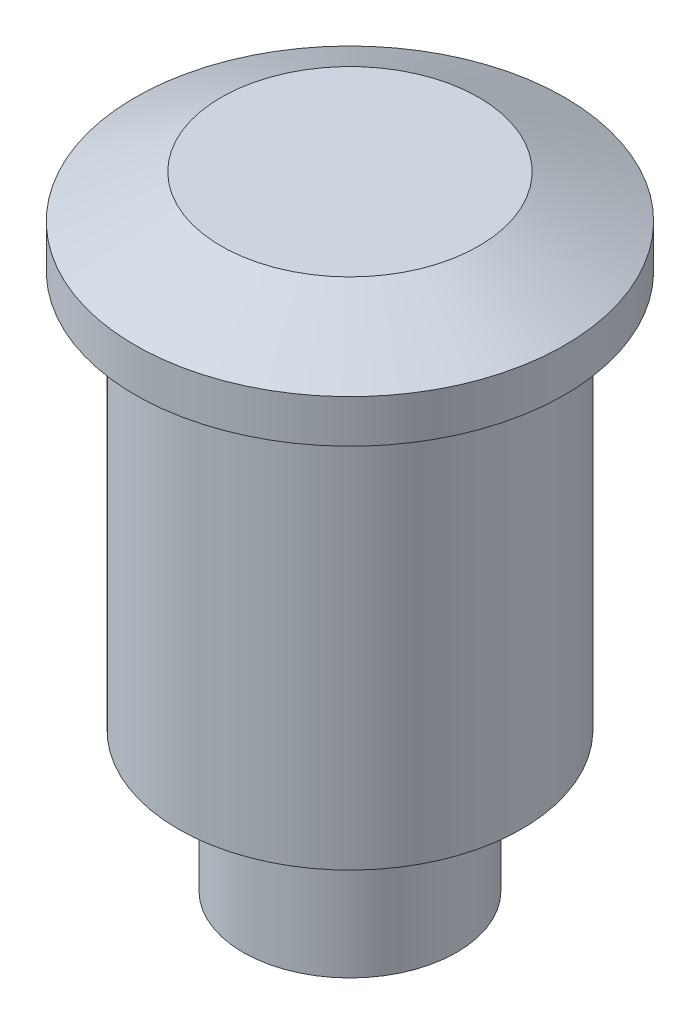
from build123d import *


with BuildPart() as part:
    # Esquisse1 → Révolution1 (revolve)
    with BuildSketch(Plane.XY, mode=Mode.PRIVATE) as r_volution1_sk:
        Polygon((0, 59.819980708), (3, 59.819980708), (5, 58.819980708), (5, 57.819980708), (4, 57.819980708), (4, 48.565491805), (2.485951674, 48.565491805), (2.485951674, 45.319980708), (0, 45.319980708), align=None)
    revolve(r_volution1_sk.sketch.rotate(Axis((0, 0, 0), (0, 1, 0)), 90), axis=Axis((0, 0, 0), (0, 1, 0)))


solid = part.part
